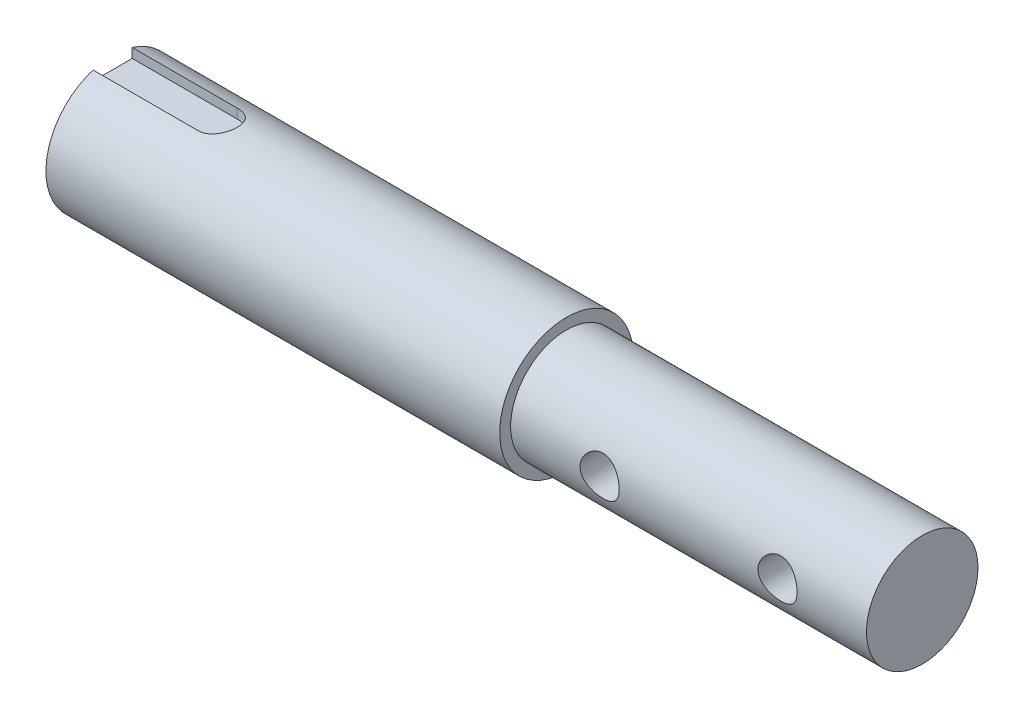
from build123d import *

# Parameters (mm, degrees)
SKETCH1_R               = 37.5
BOSS_EXTRUDE1_DEPTH     = 255
SKETCH2_R               = 31.34
BOSS_EXTRUDE2_DEPTH     = 200
CUT_EXTRUDE1_DEPTH      = 7
CUT_EXTRUDE2_DEPTH      = 459.080233163
CUT_EXTRUDE2_DEPTH_BACK = 459.080233163
SKETCH4_R               = 11


with BuildPart() as part:
    # Sketch1 → Boss-Extrude1 (new body)
    with BuildSketch(Plane(origin=(0, 0, 0), x_dir=(0, 0, -1), z_dir=(1, 0, 0))):
        Circle(SKETCH1_R)
    extrude(amount=BOSS_EXTRUDE1_DEPTH)

    # Sketch2 → Boss-Extrude2 (add)
    with BuildSketch(Plane(origin=(255, 0, 0), x_dir=(0, 0, -1), z_dir=(1, 0, 0))):
        Circle(SKETCH2_R)
    extrude(amount=BOSS_EXTRUDE2_DEPTH)

    # Sketch3 → Cut-Extrude1 (cut)
    with BuildSketch(Plane(origin=(0, 37.5, 0), x_dir=(1, 0, 0), z_dir=(0, 1, 0))):
        with BuildLine():
            Line((59, -11), (0, -11))
            Line((0, -11), (0, 11))
            Line((0, 11), (59, 11))
            ThreePointArc((59, 11), (70, 0), (59, -11))
        make_face()
    extrude(amount=-CUT_EXTRUDE1_DEPTH, mode=Mode.SUBTRACT)

    # Sketch4 → Cut-Extrude2 (cut, two sides: drawn at the far end of the back side and taken through both)
    with BuildSketch(Plane.XY.offset(-CUT_EXTRUDE2_DEPTH_BACK)):
        with Locations((405, 0)):
            Circle(SKETCH4_R)
        with Locations((305, 0)):
            Circle(SKETCH4_R)
    extrude(amount=CUT_EXTRUDE2_DEPTH + CUT_EXTRUDE2_DEPTH_BACK, mode=Mode.SUBTRACT)


solid = part.part
